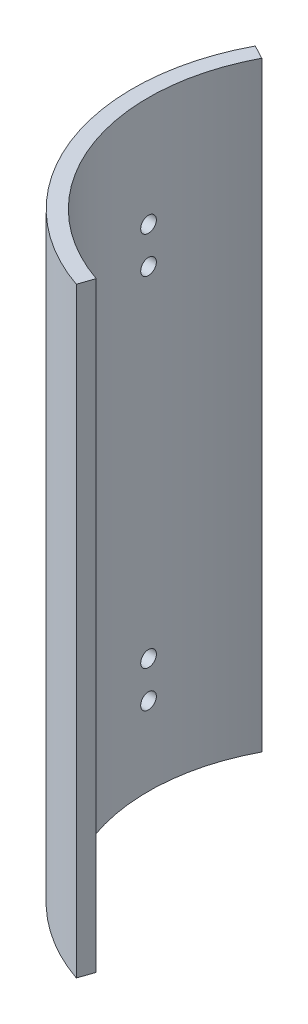
from build123d import *

# Parameters (mm, degrees)
EXTRUSION1_DEPTH = 115
ESQUISSE6_R      = 1.5
ESQUISSE6_W      = 11.044450352
ESQUISSE6_H      = 20
EXTRUSION2_DEPTH = 120


with BuildPart() as part:
    # Esquisse5 → Extrusion1 (new body)
    with BuildSketch(Plane(origin=(0, 0, 0), x_dir=(1, 0, 0), z_dir=(0, 1, 0))):
        with BuildLine():
            Line((-11.982008115, -35.006163479), (-12.953522286, -37.844501059))
            ThreePointArc((-12.953522286, -37.844501059), (-37.203278989, -14.694081546), (-35.317903714, 18.778862511))
            Line((-35.317903714, 18.778862511), (-32.669060936, 17.370447823))
            ThreePointArc((-32.669060936, 17.370447823), (-34.413033065, -13.59202543), (-11.982008115, -35.006163479))
        make_face()
    extrude(amount=EXTRUSION1_DEPTH)

    # Esquisse6 → Extrusion2 (cut)
    with BuildSketch(Plane(origin=(0, 0, 0), x_dir=(0, 0, -1), z_dir=(1, 0, 0))):
        with Locations((0, 94)):
            Circle(ESQUISSE6_R)
        with Locations((0, 87)):
            Circle(ESQUISSE6_R)
        with Locations((0, 15)):
            Circle(ESQUISSE6_R)
        with Locations((0, 22)):
            Circle(ESQUISSE6_R)
        with Locations((23.022225176, 59)):
            Rectangle(ESQUISSE6_W, ESQUISSE6_H)
    extrude(amount=-EXTRUSION2_DEPTH, mode=Mode.SUBTRACT)


solid = part.part
